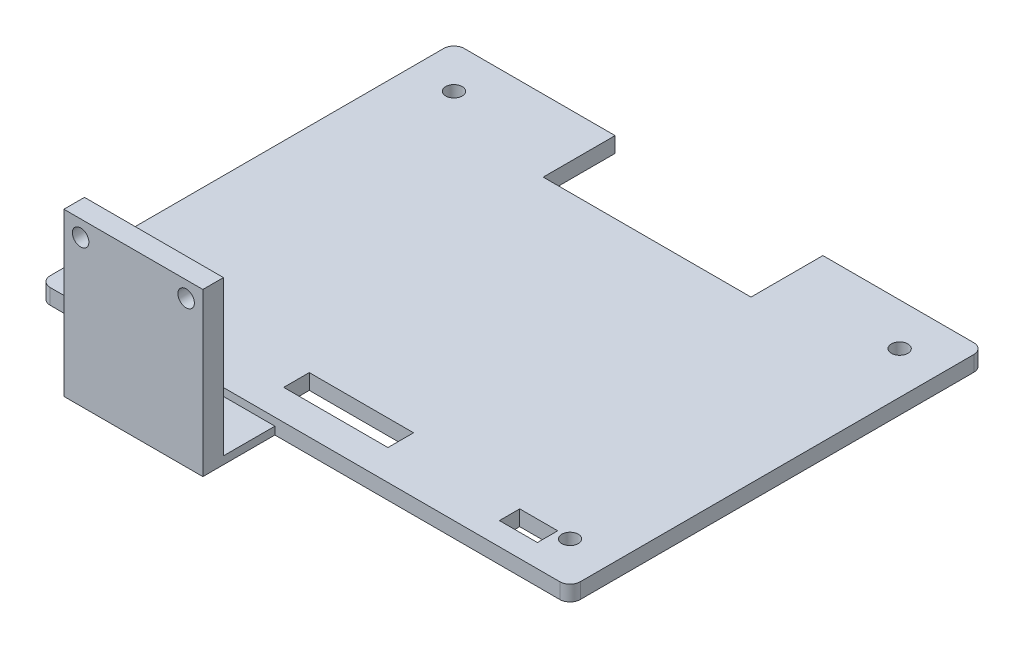
from build123d import *

# Parameters (mm, degrees)
SKETCH_1_R          = 1.6
SKETCH_1_W          = 7.387531562
SKETCH_1_H          = 3.94976935
SKETCH_1_W_2        = 20.26085389
SKETCH_1_H_2        = 4.973783626
EXTRUDE_1_DEPTH     = 3
SKETCH_2_W          = 27
SKETCH_2_H          = 1.5
EXTRUDE_2_DEPTH     = 14
SKETCH_4_W          = 27
SKETCH_4_H          = 4
EXTRUDE_3_DEPTH     = 30
SKETCH_5_R          = 1.6
CUT_EXTRUDE_1_DEPTH = 30


with BuildPart() as part:
    # 草图1 → 凸台-拉伸1 (new body)
    with BuildSketch(Plane(origin=(0, 0, 0), x_dir=(1, 0, 0), z_dir=(0, 1, 0))):
        with BuildLine():
            Line((-49.5, -40.220425864), (49.5, -40.220425864))
            ThreePointArc((49.5, -40.220425864), (50.914213562, -39.634639426), (51.5, -38.220425864))
            Line((51.5, -38.220425864), (51.5, 38.220425864))
            ThreePointArc((51.5, 38.220425864), (50.914213562, 39.634639426), (49.5, 40.220425864))
            Line((49.5, 40.220425864), (20.187430173, 40.220425864))
            Line((20.187430173, 40.220425864), (20.187430173, 26.249140852))
            Line((20.187430173, 26.249140852), (-20.187430173, 26.249140852))
            Line((-20.187430173, 26.249140852), (-20.187430173, 40.220425864))
            Line((-20.187430173, 40.220425864), (-49.5, 40.220425864))
            ThreePointArc((-49.5, 40.220425864), (-50.914213562, 39.634639426), (-51.5, 38.220425864))
            Line((-51.5, 38.220425864), (-51.5, -38.220425864))
            ThreePointArc((-51.5, -38.220425864), (-50.914213562, -39.634639426), (-49.5, -40.220425864))
        make_face()
        with Locations(Location((-43.3, -32.020425864, 0), (0, 0, 270))):
            Circle(SKETCH_1_R, mode=Mode.SUBTRACT)
        with Locations((-37.047373629, -33.829043047)):
            Rectangle(SKETCH_1_W, SKETCH_1_H, mode=Mode.SUBTRACT)
        with Locations((0.109715815, -31.854158372)):
            Rectangle(SKETCH_1_W_2, SKETCH_1_H_2, mode=Mode.SUBTRACT)
        with Locations((37.047373629, -33.829043047)):
            Rectangle(SKETCH_1_W, SKETCH_1_H, mode=Mode.SUBTRACT)
        with Locations(Location((43.3, -32.020425864, 0), (0, 0, 270))):
            Circle(SKETCH_1_R, mode=Mode.SUBTRACT)
        with Locations(Location((43.3, 32.020425864, 0), (0, 0, 270))):
            Circle(SKETCH_1_R, mode=Mode.SUBTRACT)
        with Locations(Location((-43.3, 32.020425864, 0), (0, 0, 270))):
            Circle(SKETCH_1_R, mode=Mode.SUBTRACT)
    extrude(amount=EXTRUDE_1_DEPTH)

    # 草图2 → 凸台-拉伸2 (add)
    with BuildSketch(Plane.XY.offset(40.220425864)):
        with Locations((-19.346509013, 0.75)):
            Rectangle(SKETCH_2_W, SKETCH_2_H)
    extrude(amount=EXTRUDE_2_DEPTH)

    # 草图4 → 凸台-拉伸3 (add)
    with BuildSketch(Plane(origin=(0, 1.5, 0), x_dir=(1, 0, 0), z_dir=(0, 1, 0))):
        with Locations((-19.346509013, -52.220425864)):
            Rectangle(SKETCH_4_W, SKETCH_4_H)
    extrude(amount=EXTRUDE_3_DEPTH)

    # 草图5 → 切除-拉伸1 (cut)
    with BuildSketch(Plane.XY.offset(54.220425864)):
        with Locations((-29.596509013, 28.381274353)):
            Circle(SKETCH_5_R)
        with Locations((-9.096509013, 28.381274353)):
            Circle(SKETCH_5_R)
    extrude(amount=-CUT_EXTRUDE_1_DEPTH, mode=Mode.SUBTRACT)


solid = part.part
